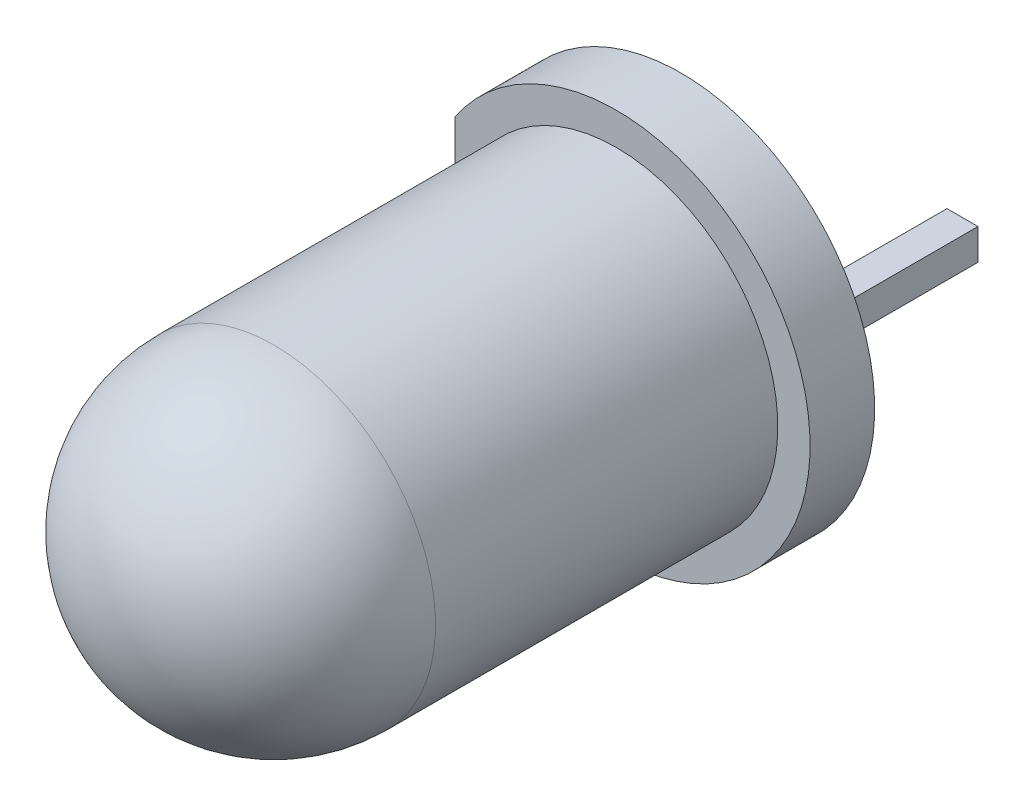
from build123d import *

# Parameters (mm, degrees)
ESBO_O1_R                  = 3
RESSALTO_EXTRUS_O1_DEPTH   = 1
CORTE_EXTRUS_O1_DEPTH      = 1
ESBO_O5_W                  = 0.48
ESBO_O5_H                  = 0.48
RESSALTO_EXTRUS_O2_DEPTH   = 1
RESSALTO_EXTRUS_O2_2_DEPTH = 1
ESBO_O6_W                  = 0.48
ESBO_O6_H                  = 0.48
RESSALTO_EXTRUS_O3_DEPTH   = 2
CORTE_EXTRUS_O2_DEPTH      = 0.24
RESSALTO_EXTRUS_O4_DEPTH   = 0.24
RESSALTO_EXTRUS_O4_2_DEPTH = 0.24
ESBO_O12_R                 = 0.2
CORTE_EXTRUS_O3_DEPTH      = 0.1


with BuildPart() as part:
    # Esboço1 → Ressalto-extrusão1 (new body)
    with BuildSketch(Plane.XY):
        Circle(ESBO_O1_R)
    extrude(amount=RESSALTO_EXTRUS_O1_DEPTH)

    # Esboço3 → Revolução1 (revolve)
    with BuildSketch(Plane(origin=(0, 0, 0), x_dir=(0, 0, -1), z_dir=(1, 0, 0))):
        with BuildLine():
            Line((-1, 0), (-8.8, 0))
            ThreePointArc((-8.8, 0), (-8.067766953, 1.767766953), (-6.3, 2.5))
            Line((-6.3, 2.5), (-1, 2.5))
            Line((-1, 2.5), (-1, 0))
        make_face()
    revolve(axis=Axis((0, 0, 1), (0, 0, 1)))

    # Esboço4 → Corte-extrusão1 (cut)
    with BuildSketch(Plane(origin=(0, 0, 0), x_dir=(-1, 0, 0), z_dir=(0, 0, -1))):
        with BuildLine():
            Line((2.5, 1.658312395), (2.5, -1.658312395))
            ThreePointArc((2.5, -1.658312395), (3, 0), (2.5, 1.658312395))
        make_face()
    extrude(amount=-CORTE_EXTRUS_O1_DEPTH, mode=Mode.SUBTRACT)

    # Esboço7 → Corte-extrusão2 (cut, symmetric)
    with BuildSketch(Plane(origin=(0, 0, 0), x_dir=(1, 0, 0), z_dir=(0, 1, 0))):
        Polygon((-1.6, 0), (-1.6, -3.5), (-1.3, -4), (1.2, -4), (0.02, -2), (-1.12, -2), (-1.12, 0), align=None)
        Polygon((1.6, 0), (1.6, -4), (1.4, -4), (0.22, -2), (1.12, -2), (1.12, 0), align=None)
    extrude(amount=CORTE_EXTRUS_O2_DEPTH, both=True, mode=Mode.SUBTRACT)


with BuildPart() as body_2:
    # Esboço5 → Ressalto-extrusão2 (new body)
    with BuildSketch(Plane(origin=(0, 0, 0), x_dir=(-1, 0, 0), z_dir=(0, 0, -1))):
        with Locations((-1.36, 0)):
            Rectangle(ESBO_O5_W, ESBO_O5_H)
    extrude(amount=RESSALTO_EXTRUS_O2_DEPTH)


with BuildPart() as body_3:
    # Esboço5 → Ressalto-extrus_o2 2 (new body)
    with BuildSketch(Plane(origin=(0, 0, 0), x_dir=(-1, 0, 0), z_dir=(0, 0, -1))):
        with Locations((1.36, 0)):
            Rectangle(ESBO_O5_W, ESBO_O5_H)
    extrude(amount=RESSALTO_EXTRUS_O2_2_DEPTH)


with BuildPart() as body_4:
    # Esboço6 → Ressalto-extrusão3 (new body)
    with BuildSketch(Plane(origin=(0, 0, -1), x_dir=(-1, 0, 0), z_dir=(0, 0, -1))):
        with Locations((-1.36, 0)):
            Rectangle(ESBO_O6_W, ESBO_O6_H)
    extrude(amount=RESSALTO_EXTRUS_O3_DEPTH)


with BuildPart() as body_5:
    # Esboço8 → Ressalto-extrusão4 (new, symmetric)
    with BuildSketch(Plane(origin=(0, 0, 0), x_dir=(1, 0, 0), z_dir=(0, 1, 0))):
        Polygon((-1.3, -4), (1.2, -4), (0.02, -2), (-1.12, -2), (-1.12, 0), (-1.6, 0), (-1.6, -3.5), align=None)
    extrude(amount=RESSALTO_EXTRUS_O4_DEPTH, both=True)

    # Combinar2: union body 3
    add(body_3.part)

    # Esboço10 → Corte-Revolução1 (revolve, cut)
    with BuildSketch(Plane(origin=(0, 0, 0), x_dir=(1, 0, 0), z_dir=(0, 1, 0))):
        with BuildLine():
            Line((-0.05, -4), (-0.05, -3.7))
            ThreePointArc((-0.05, -3.7), (-0.341547595, -3.780754009), (-0.55, -4))
            Line((-0.55, -4), (-0.05, -4))
        make_face()
    revolve(axis=Axis((-0.05, 0, 4), (0, 0, -1)), mode=Mode.SUBTRACT)


with BuildPart() as body_6:
    # Esboço8 → Ressalto-extrus_o4 2 (new, symmetric)
    with BuildSketch(Plane(origin=(0, 0, 0), x_dir=(1, 0, 0), z_dir=(0, 1, 0))):
        Polygon((0.22, -2), (1.4, -4), (1.6, -4), (1.6, 0), (1.12, 0), (1.12, -2), align=None)
    extrude(amount=RESSALTO_EXTRUS_O4_2_DEPTH, both=True)

    # Combinar1: union body 4, body 2
    add(body_4.part)
    add(body_2.part)


with BuildPart() as body_4_2:
    # Esboço11 → Revolução2 (revolve)
    with BuildSketch(Plane(origin=(0, 0, 0), x_dir=(1, 0, 0), z_dir=(0, 1, 0))):
        with BuildLine():
            Line((-0.55, -4), (-0.05, -4))
            Line((-0.05, -4), (-0.05, -3.7))
            ThreePointArc((-0.05, -3.7), (-0.341547595, -3.780754009), (-0.55, -4))
        make_face()
    revolve(axis=Axis((-0.05, 0, 4), (0, 0, -1)))

    # Combinar3: union body 5
    add(body_5.part)

    # Esboço12 → Corte-extrusão3 (cut)
    with BuildSketch(Plane.XY.offset(4)):
        with Locations((-0.05, 0)):
            Circle(ESBO_O12_R)
    extrude(amount=-CORTE_EXTRUS_O3_DEPTH, mode=Mode.SUBTRACT)


solid = Compound([part.part, body_6.part, body_4_2.part])
